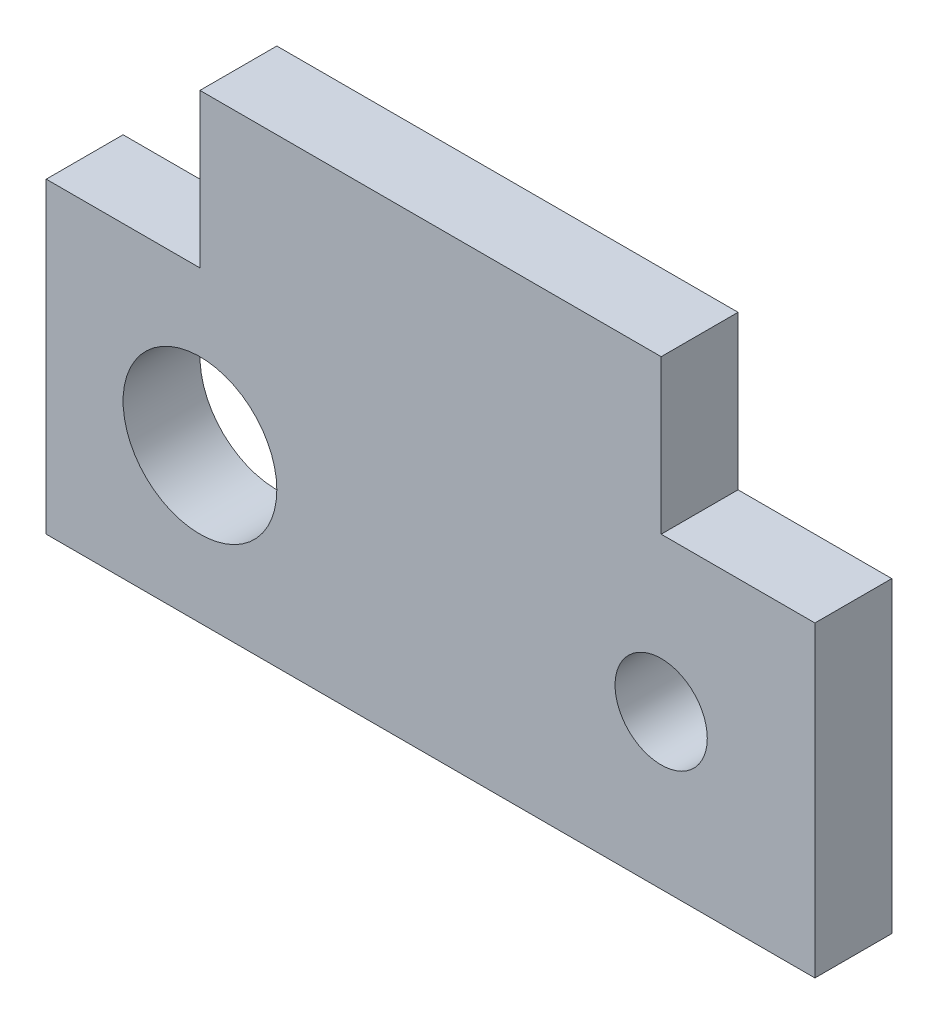
from build123d import *

# Parameters (mm, degrees)
CROQUIS1_R              = 5
CROQUIS1_R_2            = 3
SALIENTE_EXTRUIR1_DEPTH = 5


with BuildPart() as part:
    # Croquis1 → Saliente-Extruir1 (new body)
    with BuildSketch(Plane.XY):
        Polygon((40, 20), (50, 20), (50, 0), (0, 0), (0, 20), (10, 20), (10, 30), (40, 30), align=None)
        with Locations((10, 10)):
            Circle(CROQUIS1_R, mode=Mode.SUBTRACT)
        with Locations((40, 10)):
            Circle(CROQUIS1_R_2, mode=Mode.SUBTRACT)
    extrude(amount=SALIENTE_EXTRUIR1_DEPTH)


solid = part.part
